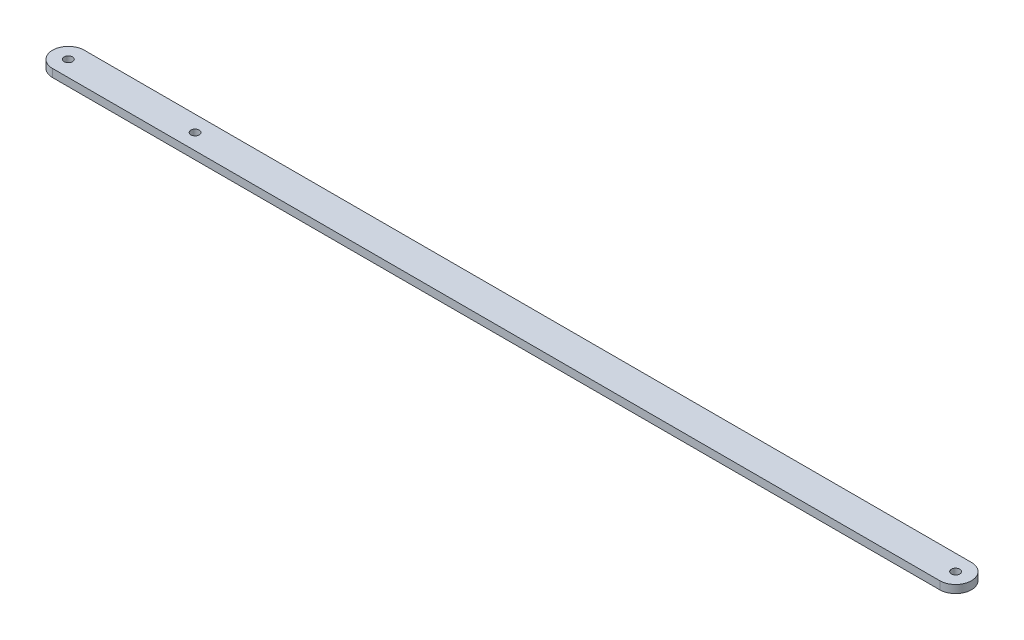
from build123d import *

# Parameters (mm, degrees)
SKETCH1_R           = 3.3655
BOSS_EXTRUDE1_DEPTH = 6.35


with BuildPart() as part:
    # Sketch1 → Boss-Extrude1 (new body)
    with BuildSketch(Plane(origin=(0, 0, 0), x_dir=(1, 0, 0), z_dir=(0, 1, 0))):
        with BuildLine():
            Line((-355.6, 12.7), (355.6, 12.7))
            ThreePointArc((355.6, 12.7), (368.3, 0), (355.6, -12.7))
            Line((355.6, -12.7), (-355.6, -12.7))
            ThreePointArc((-355.6, -12.7), (-368.3, 0), (-355.6, 12.7))
        make_face()
        with Locations(Location((355.6, 0, 0), (0, 0, 270))):
            Circle(SKETCH1_R, mode=Mode.SUBTRACT)
        with Locations(Location((-254, 0, 0), (0, 0, 270))):
            Circle(SKETCH1_R, mode=Mode.SUBTRACT)
        with Locations(Location((-355.6, 0, 0), (0, 0, 270))):
            Circle(SKETCH1_R, mode=Mode.SUBTRACT)
    extrude(amount=BOSS_EXTRUDE1_DEPTH)


solid = part.part
